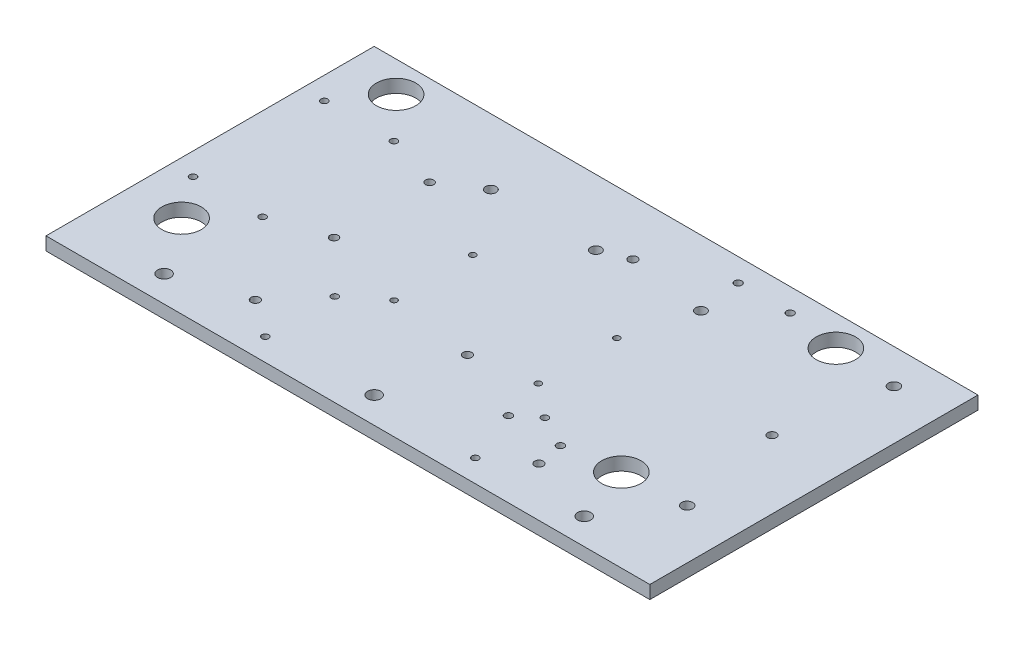
from build123d import *

# Parameters (mm, degrees)
SKETCH1_W           = 292.1
SKETCH1_H           = 158.75
BOSS_EXTRUDE1_DEPTH = 6.35
SKETCH2_R           = 3.175
CUT_EXTRUDE2_DEPTH  = 6.35
SKETCH6_R           = 9.525
CUT_EXTRUDE3_DEPTH  = 333.512097524
SKETCH8_R           = 2.667
SKETCH8_R_2         = 2.54
SKETCH8_R_3         = 1.5
SKETCH8_R_4         = 1.651
SKETCH8_R_5         = 2.0955
SKETCH8_R_6         = 1.7907
SKETCH8_R_7         = 1.9685
CUT_EXTRUDE4_DEPTH  = 333.512097524


with BuildPart() as part:
    # Sketch1 → Boss-Extrude1 (new body)
    with BuildSketch(Plane(origin=(0, 0, 0), x_dir=(1, 0, 0), z_dir=(0, 1, 0))):
        with Locations((146.05, 79.375)):
            Rectangle(SKETCH1_W, SKETCH1_H)
    extrude(amount=BOSS_EXTRUDE1_DEPTH)

    # Sketch2 → Cut-Extrude2 (cut)
    with BuildSketch(Plane(origin=(0, 6.35, 0), x_dir=(1, 0, 0), z_dir=(0, 1, 0))):
        with Locations(Location((146.05, 12.7, 0), (0, 0, 270))):
            Circle(SKETCH2_R)
        with Locations(Location((247.65, 12.7, 0), (0, 0, 270))):
            Circle(SKETCH2_R)
        with Locations(Location((44.45, 12.7, 0), (0, 0, 270))):
            Circle(SKETCH2_R)
    extrude(amount=-CUT_EXTRUDE2_DEPTH, mode=Mode.SUBTRACT)

    # Sketch6 → Cut-Extrude3 (cut, through all)
    with BuildSketch(Plane(origin=(0, 6.35, 0), x_dir=(1, 0, 0), z_dir=(0, 1, 0))):
        with Locations(Location((25.4, 40.187936889, 0), (0, 0, 270))):
            Circle(SKETCH6_R)
        with Locations(Location((238.125, 40.187936889, 0), (0, 0, 270))):
            Circle(SKETCH6_R)
        with Locations(Location((25.4, 143.962063111, 0), (0, 0, 270))):
            Circle(SKETCH6_R)
        with Locations(Location((238.125, 143.962063111, 0), (0, 0, 270))):
            Circle(SKETCH6_R)
    extrude(amount=-CUT_EXTRUDE3_DEPTH, mode=Mode.SUBTRACT)

    # Sketch8 → Cut-Extrude4 (cut, through all)
    with BuildSketch(Plane(origin=(0, 6.35, 0), x_dir=(1, 0, 0), z_dir=(0, 1, 0))):
        with Locations(Location((268.097, 42.075, 0), (0, 0, 270))):
            Circle(SKETCH8_R)
        with Locations(Location((268.097, 142.075, 0), (0, 0, 270))):
            Circle(SKETCH8_R)
        with Locations(Location((189.8015, 127, 0), (0, 0, 270))):
            Circle(SKETCH8_R_2)
        with Locations(Location((139.0015, 127, 0), (0, 0, 270))):
            Circle(SKETCH8_R_2)
        with Locations(Location((88.2015, 127, 0), (0, 0, 270))):
            Circle(SKETCH8_R_2)
        with Locations(Location((111.2, 57.2, 0), (0, 0, 270))):
            Circle(SKETCH8_R_3)
        with Locations(Location((180.9, 57.2, 0), (0, 0, 270))):
            Circle(SKETCH8_R_3)
        with Locations(Location((180.9, 95.2, 0), (0, 0, 270))):
            Circle(SKETCH8_R_3)
        with Locations(Location((111.2, 95.2, 0), (0, 0, 270))):
            Circle(SKETCH8_R_3)
        with Locations(Location((95.25, 10.795, 0), (0, 0, 270))):
            Circle(SKETCH8_R_4)
        with Locations(Location((196.85, 10.795, 0), (0, 0, 270))):
            Circle(SKETCH8_R_4)
        with Locations(Location((196.85, 44.45, 0), (0, 0, 270))):
            Circle(SKETCH8_R_4)
        with Locations(Location((95.25, 44.45, 0), (0, 0, 270))):
            Circle(SKETCH8_R_4)
        with Locations(Location((10.795, 123.825, 0), (0, 0, 270))):
            Circle(SKETCH8_R_4)
        with Locations(Location((10.795, 60.325, 0), (0, 0, 270))):
            Circle(SKETCH8_R_4)
        with Locations(Location((44.45, 60.325, 0), (0, 0, 270))):
            Circle(SKETCH8_R_4)
        with Locations(Location((44.45, 123.825, 0), (0, 0, 270))):
            Circle(SKETCH8_R_4)
        with Locations(Location((77.450977137, 23.8125, 0), (0, 0, 270))):
            Circle(SKETCH8_R_5)
        with Locations(Location((151.8, 132.099022863, 0), (0, 0, 270))):
            Circle(SKETCH8_R_5)
        with Locations(Location((214.649022863, 23.8125, 0), (0, 0, 270))):
            Circle(SKETCH8_R_5)
        with Locations(Location((151.8, 52.050977137, 0), (0, 0, 270))):
            Circle(SKETCH8_R_5)
        with Locations(Location((259.099022863, 92.075, 0), (0, 0, 270))):
            Circle(SKETCH8_R_5)
        with Locations(Location((187.1695, 36.5252, 0), (0, 0, 270))):
            Circle(SKETCH8_R_6)
        with Locations(Location((212.3155, 36.5252, 0), (0, 0, 270))):
            Circle(SKETCH8_R_6)
        with Locations(Location((212.3155, 147.6248, 0), (0, 0, 270))):
            Circle(SKETCH8_R_6)
        with Locations(Location((187.1695, 147.6248, 0), (0, 0, 270))):
            Circle(SKETCH8_R_6)
        with Locations(Location((70.3882, 115.2108, 0), (0, 0, 270))):
            Circle(SKETCH8_R_7)
        with Locations(Location((70.3882, 68.9392, 0), (0, 0, 270))):
            Circle(SKETCH8_R_7)
    extrude(amount=-CUT_EXTRUDE4_DEPTH, mode=Mode.SUBTRACT)


solid = part.part
